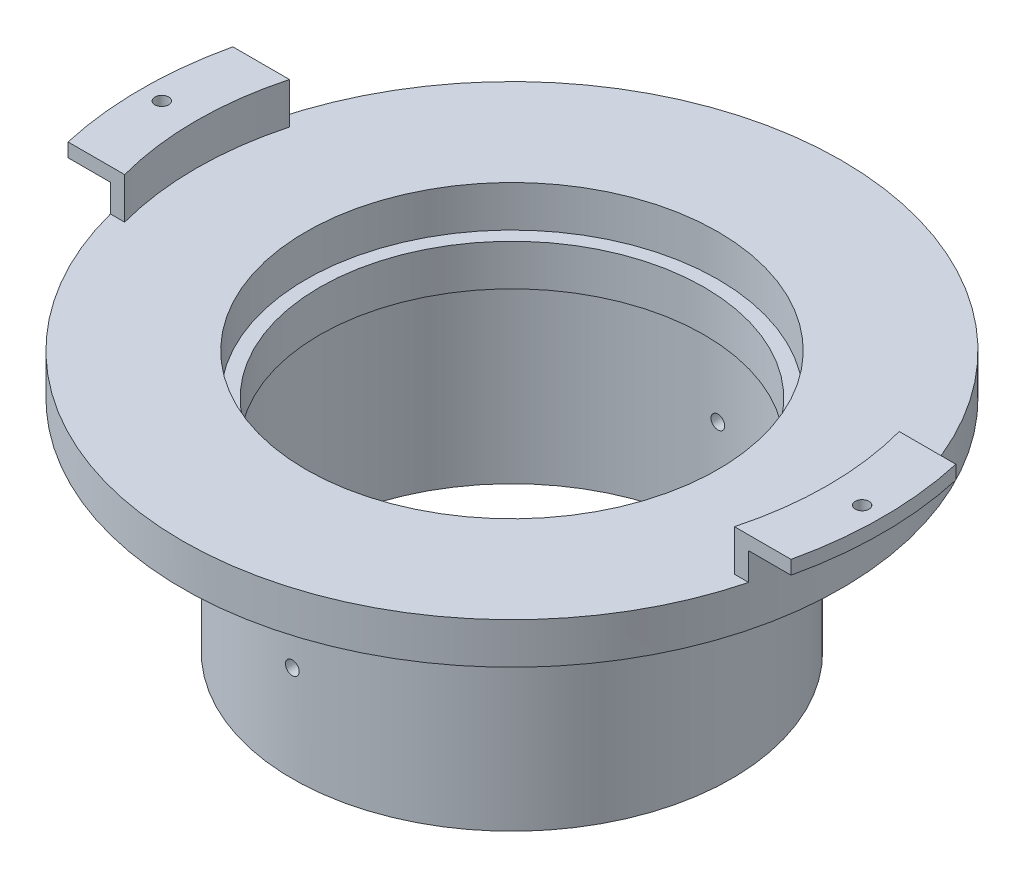
from build123d import *

# Parameters (mm, degrees)
SKETCH2_R               = 2.5
CUT_EXTRUDE3_DEPTH      = 5
CUT_EXTRUDE4_REACH      = 222.341
CUT_EXTRUDE6_DEPTH      = 205.08331632
CUT_EXTRUDE6_DEPTH_BACK = 205.08331632
SKETCH6_R               = 2.5


with BuildPart() as part:
    # Sketch1 → Revolve1 (revolve)
    with BuildSketch(Plane.XY, mode=Mode.PRIVATE) as revolve1_sk:
        Polygon((-80, -95), (-80, -15), (-120, -15), (-120, 10), (-135, 10), (-135, 15), (-115, 15), (-115, 0), (-75, 0), (-75, -15), (-70, -15), (-70, -30), (-75, -30), (-75, -95), align=None)
    revolve(revolve1_sk.sketch.rotate(Axis((0, -100.5, 0), (0, 1, 0)), 270), axis=Axis((0, -100.5, 0), (0, 1, 0)))

    # Sketch2 → Cut-Extrude3 (cut)
    with BuildSketch(Plane.XZ.offset(-10)):
        with Locations(Location((127.5, 0, 0), (0, 0, 270))):
            Circle(SKETCH2_R)
        with Locations(Location((-127.5, 0, 0), (0, 0, 270))):
            Circle(SKETCH2_R)
    extrude(amount=-CUT_EXTRUDE3_DEPTH, mode=Mode.SUBTRACT)

    # Cut-Extrude4: up to this face of the body (flat: up to its plane)
    cut_extrude4_end = Plane(part.part.faces().sort_by_distance((0, 0, 111.747308807))[0])
    # Sketch3 → Cut-Extrude4 (cut, up to the picked face)
    with BuildSketch(Plane(origin=(0, 15, 0), x_dir=(1, 0, 0), z_dir=(0, 1, 0)), mode=Mode.PRIVATE) as cut_extrude4_sk1:
        with BuildLine():
            Line((-111.018016556, -30), (-131.624465811, -30))
            ThreePointArc((-131.624465811, -30), (0, -135), (131.624465811, -30))
            Line((131.624465811, -30), (111.018016556, -30))
            ThreePointArc((111.018016556, -30), (0, -115), (-111.018016556, -30))
        make_face()
    cut_extrude4_tool1 = split(extrude(cut_extrude4_sk1.sketch, amount=-CUT_EXTRUDE4_REACH, mode=Mode.PRIVATE), bisect_by=cut_extrude4_end, keep=Keep.BOTH, mode=Mode.PRIVATE)
    # Sketch3 → Cut-Extrude4 (cut, up to the picked face)
    with BuildSketch(Plane(origin=(0, 15, 0), x_dir=(1, 0, 0), z_dir=(0, 1, 0)), mode=Mode.PRIVATE) as cut_extrude4_sk2:
        with BuildLine():
            Line((131.624465811, 30), (111.018016556, 30))
            ThreePointArc((111.018016556, 30), (0, 115), (-111.018016556, 30))
            Line((-111.018016556, 30), (-131.624465811, 30))
            ThreePointArc((-131.624465811, 30), (0, 135), (131.624465811, 30))
        make_face()
    cut_extrude4_tool2 = split(extrude(cut_extrude4_sk2.sketch, amount=-CUT_EXTRUDE4_REACH, mode=Mode.PRIVATE), bisect_by=cut_extrude4_end, keep=Keep.BOTH, mode=Mode.PRIVATE)
    add(cut_extrude4_tool1.solids().sort_by(Axis((-121.321241, 15, 32.834167), (0, -1, 0)))[0], mode=Mode.SUBTRACT)
    add(cut_extrude4_tool2.solids().sort_by(Axis((-121.321241, 15, -32.834167), (0, -1, 0)))[0], mode=Mode.SUBTRACT)

    # Sketch6 → Cut-Extrude6 (cut, two sides: drawn at the far end of the back side and taken through both)
    with BuildSketch(Plane.XY.offset(-CUT_EXTRUDE6_DEPTH_BACK)):
        with Locations((0, -60)):
            Circle(SKETCH6_R)
    extrude(amount=CUT_EXTRUDE6_DEPTH + CUT_EXTRUDE6_DEPTH_BACK, mode=Mode.SUBTRACT)


solid = part.part
